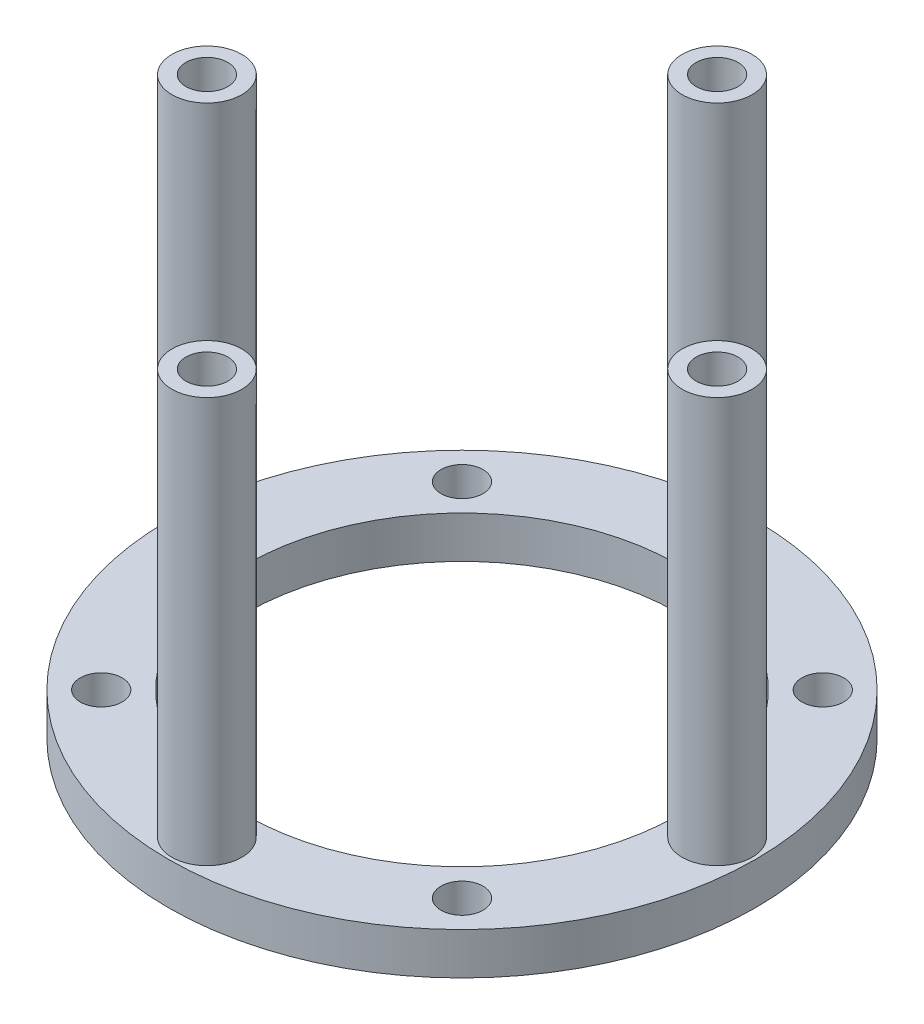
from build123d import *

# Parameters (mm, degrees)
SKETCH1_R           = 21
SKETCH1_R_2         = 15.5
SKETCH1_R_3         = 1.5
BOSS_EXTRUDE1_DEPTH = 3
SKETCH2_R           = 2.5
BOSS_EXTRUDE2_DEPTH = 29
CUT_EXTRUDE1_START  = -5
SKETCH3_R           = 1.5
CUT_EXTRUDE1_DEPTH  = 5


with BuildPart() as part:
    # Sketch1 → Boss-Extrude1 (new body)
    with BuildSketch(Plane(origin=(0, 0, 0), x_dir=(1, 0, 0), z_dir=(0, 1, 0))):
        with Locations(Location((0, 0, 0), (0, 0, 270))):
            Circle(SKETCH1_R)
        with Locations(Location((0, 0, 0), (0, 0, 270))):
            Circle(SKETCH1_R_2, mode=Mode.SUBTRACT)
        with Locations(Location((0, 18.25, 0), (0, 0, 270))):
            Circle(SKETCH1_R_3, mode=Mode.SUBTRACT)
        with Locations(Location((12.904698757, 12.904698757, 0), (0, 0, 270))):
            Circle(SKETCH1_R_3, mode=Mode.SUBTRACT)
        with Locations(Location((18.25, 0, 0), (0, 0, 270))):
            Circle(SKETCH1_R_3, mode=Mode.SUBTRACT)
        with Locations(Location((12.904698757, -12.904698757, 0), (0, 0, 270))):
            Circle(SKETCH1_R_3, mode=Mode.SUBTRACT)
        with Locations(Location((0, -18.25, 0), (0, 0, 270))):
            Circle(SKETCH1_R_3, mode=Mode.SUBTRACT)
        with Locations(Location((-12.904698757, -12.904698757, 0), (0, 0, 270))):
            Circle(SKETCH1_R_3, mode=Mode.SUBTRACT)
        with Locations(Location((-18.25, 0, 0), (0, 0, 270))):
            Circle(SKETCH1_R_3, mode=Mode.SUBTRACT)
        with Locations(Location((-12.904698757, 12.904698757, 0), (0, 0, 270))):
            Circle(SKETCH1_R_3, mode=Mode.SUBTRACT)
    extrude(amount=BOSS_EXTRUDE1_DEPTH)

    # Sketch2 → Boss-Extrude2 (add)
    with BuildSketch(Plane(origin=(0, 3, 0), x_dir=(1, 0, 0), z_dir=(0, 1, 0))):
        with Locations(Location((0, 18.25, 0), (0, 0, 90))):
            Circle(SKETCH2_R)
        with Locations(Location((18.25, 0, 0), (0, 0, 90))):
            Circle(SKETCH2_R)
        with Locations(Location((0, -18.25, 0), (0, 0, 90))):
            Circle(SKETCH2_R)
        with Locations(Location((-18.25, 0, 0), (0, 0, 90))):
            Circle(SKETCH2_R)
    extrude(amount=BOSS_EXTRUDE2_DEPTH)

    # Sketch3 → Cut-Extrude1 (cut)
    with BuildSketch(Plane(origin=(0, 32, 0), x_dir=(1, 0, 0), z_dir=(0, 1, 0)).offset(CUT_EXTRUDE1_START)):
        with Locations(Location((18.25, 0, 0), (0, 0, 270))):
            Circle(SKETCH3_R)
        with Locations(Location((0, 18.25, 0), (0, 0, 270))):
            Circle(SKETCH3_R)
        with Locations(Location((0, -18.25, 0), (0, 0, 270))):
            Circle(SKETCH3_R)
        with Locations(Location((-18.25, 0, 0), (0, 0, 270))):
            Circle(SKETCH3_R)
    extrude(amount=CUT_EXTRUDE1_DEPTH, mode=Mode.SUBTRACT)


solid = part.part
